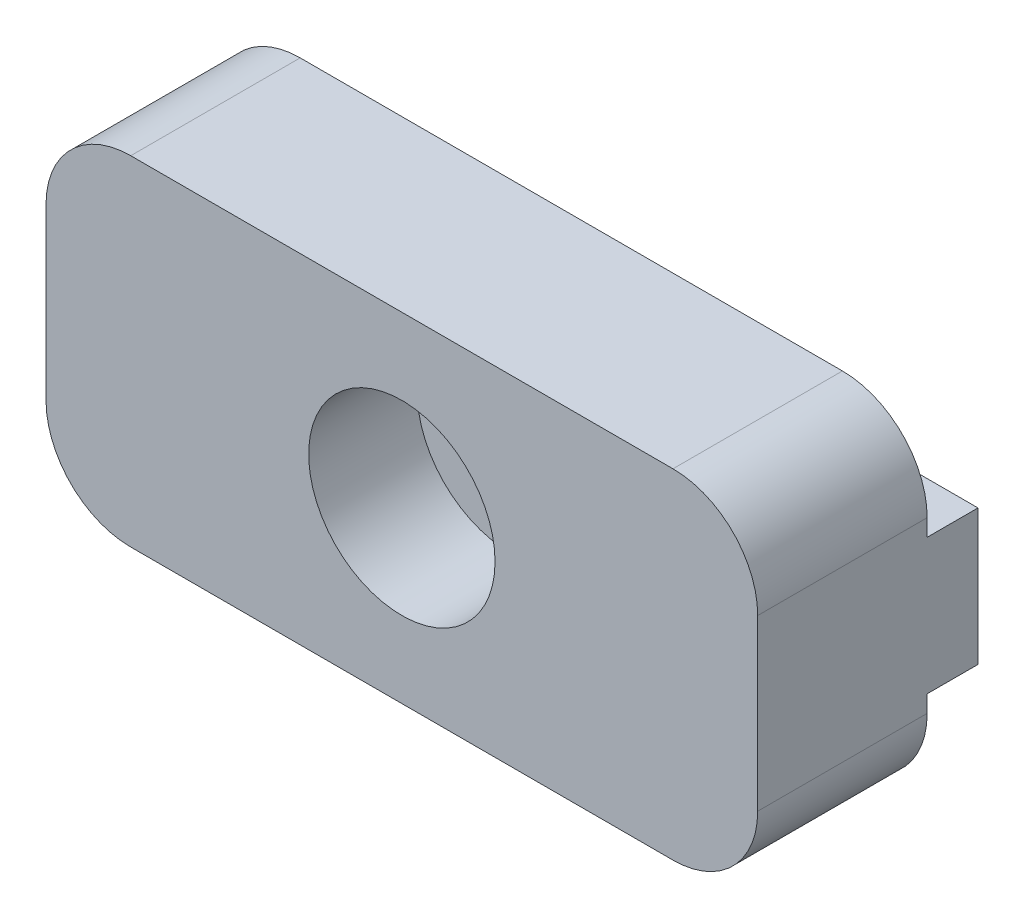
from build123d import *

# Parameters (mm, degrees)
BASE_SKETCH_W           = 42
BASE_SKETCH_H           = 20
BASE_DEPTH              = 10
MOUNT_SCREW_D           = 6.6
MOUNT_SCREW_CBORE_D     = 11
MOUNT_SCREW_CBORE_DEPTH = 6.4
PROFILE_CLIP_DEPTH      = 3
ZAOBLIT1_R              = 5


with BuildPart() as part:
    # Base sketch → Base (new body)
    with BuildSketch(Plane.XY):
        Rectangle(BASE_SKETCH_W, BASE_SKETCH_H)
    extrude(amount=BASE_DEPTH)

    # Mount screw (through all)
    with Locations(Plane.XY.offset(10)):
        with Locations((0, 0)):
            CounterBoreHole(MOUNT_SCREW_D / 2, MOUNT_SCREW_CBORE_D / 2, MOUNT_SCREW_CBORE_DEPTH)

    # Profile clip sketch → Profile clip (add)
    with BuildSketch(Plane(origin=(0, 0, 0), x_dir=(-1, 0, 0), z_dir=(0, 0, -1))):
        with BuildLine():
            Line((-8.062257748, 4), (-21, 4))
            Line((-21, 4), (-21, -4))
            Line((-21, -4), (-8.062257748, -4))
            ThreePointArc((-8.062257748, -4), (-9, 0), (-8.062257748, 4))
        make_face()
        with BuildLine():
            Line((21, 4), (8.062257748, 4))
            ThreePointArc((8.062257748, 4), (8.762428879, 2.054224947), (9, 0))
            ThreePointArc((9, 0), (8.762428879, -2.054224947), (8.062257748, -4))
            Line((8.062257748, -4), (21, -4))
            Line((21, -4), (21, 4))
        make_face()
    extrude(amount=PROFILE_CLIP_DEPTH)

    # Zaoblit1
    zaoblit1_edges = [part.edges().sort_by_distance(p)[0] for p in [
        (21, -10, 5),
        (-21, -10, 5),
        (-21, 10, 5),
        (21, 10, 5),
    ]]
    fillet(zaoblit1_edges, radius=ZAOBLIT1_R)


solid = part.part
